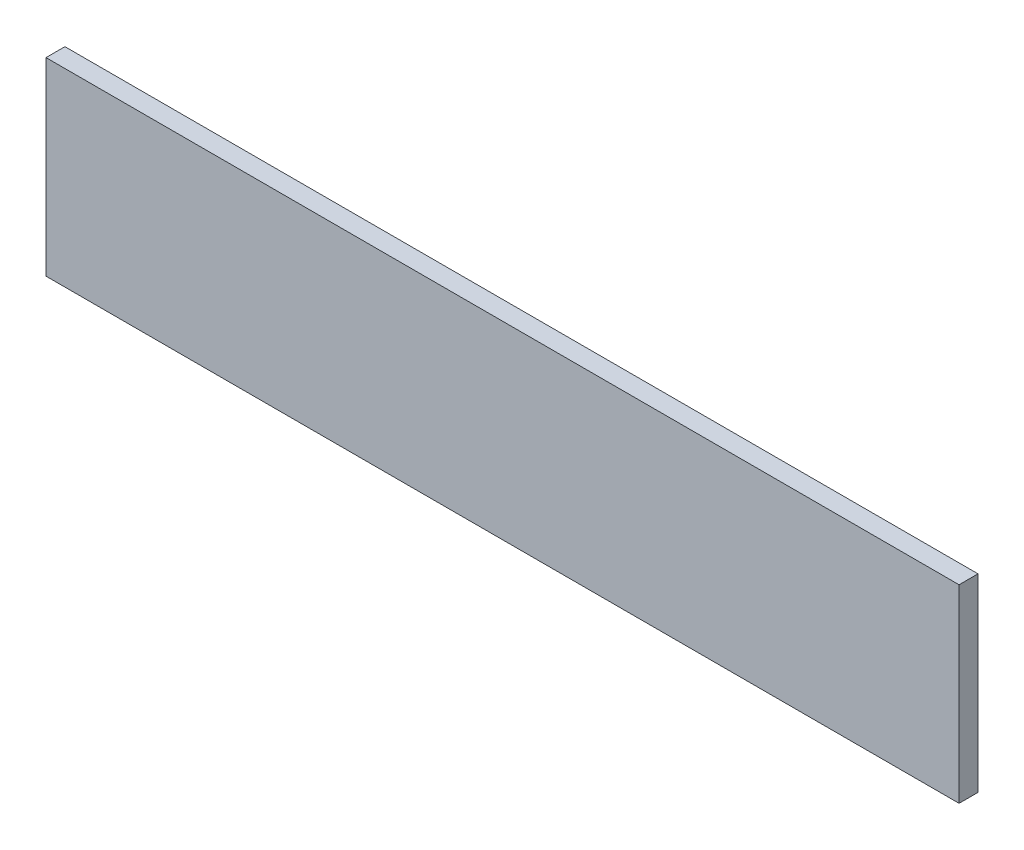
from build123d import *

# Parameters (mm, degrees)
SKETCH1_W           = 48.23
SKETCH1_H           = 10
BOSS_EXTRUDE1_DEPTH = 1


with BuildPart() as part:
    # Sketch1 → Boss-Extrude1 (new body)
    with BuildSketch(Plane.XY):
        with Locations((24.115, 5)):
            Rectangle(SKETCH1_W, SKETCH1_H)
    extrude(amount=BOSS_EXTRUDE1_DEPTH)


solid = part.part
